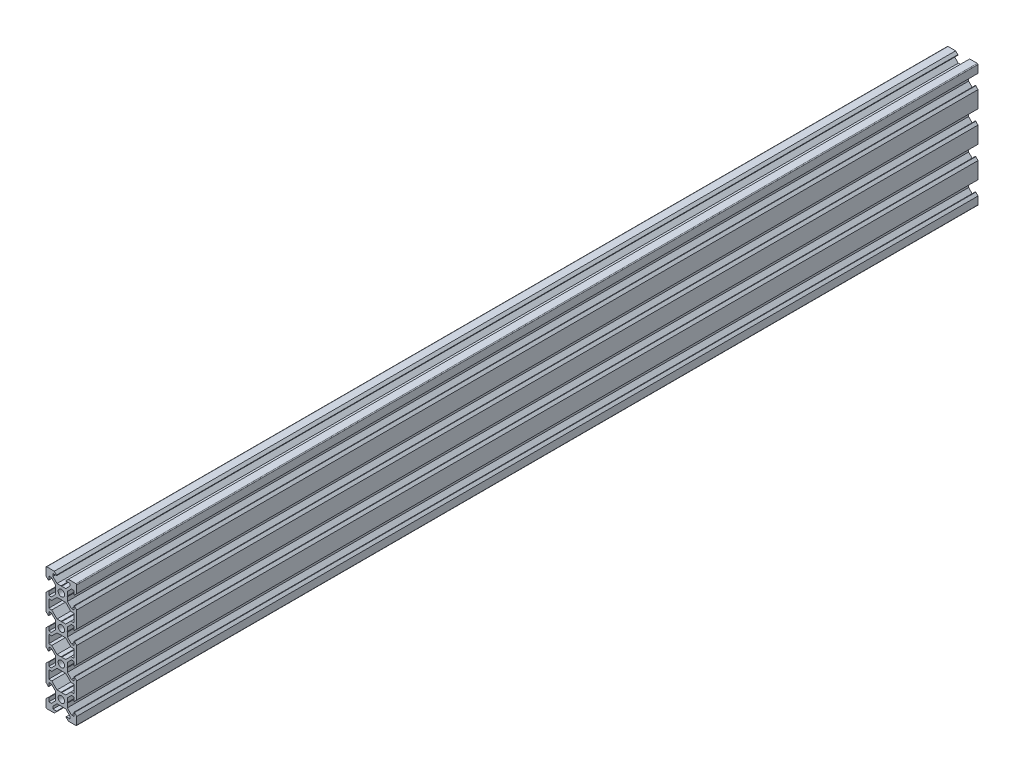
from build123d import *

# Parameters (mm, degrees)
BOSS_EXTRU_1_DEPTH = 586.8


with BuildPart() as part:
    # Esquisse1 → Boss.-Extru.1 (new body)
    with BuildSketch(Plane.XY):
        with BuildLine():
            Line((-9.5, 10), (-4.58, 10))
            Line((-4.58, 10), (-3.125, 8.545))
            Line((-3.125, 8.545), (-3.125, 8.2))
            Line((-3.125, 8.2), (-5.5, 8.2))
            Line((-5.5, 8.2), (-5.5, 6.560660172))
            Line((-5.5, 6.560660172), (-2.839339828, 3.9))
            Line((-2.839339828, 3.9), (-0.21, 3.9))
            Line((-0.21, 3.9), (0, 3.69))
            Line((0, 3.69), (0, 2.1))
            ThreePointArc((0, 2.1), (-2.1, 0), (0, -2.1))
            Line((0, -2.1), (0, -3.69))
            Line((0, -3.69), (-0.21, -3.9))
            Line((-0.21, -3.9), (-2.839339828, -3.9))
            Line((-2.839339828, -3.9), (-6.239339828, -7.3))
            Line((-6.239339828, -7.3), (-8.2, -7.3))
            Line((-8.2, -7.3), (-8.2, -12.7))
            Line((-8.2, -12.7), (-6.239339828, -12.7))
            Line((-6.239339828, -12.7), (-2.839339828, -16.1))
            Line((-2.839339828, -16.1), (-0.21, -16.1))
            Line((-0.21, -16.1), (0, -16.31))
            Line((0, -16.31), (0, -17.9))
            ThreePointArc((0, -17.9), (-2.1, -20), (0, -22.1))
            Line((0, -22.1), (0, -23.69))
            Line((0, -23.69), (-0.21, -23.9))
            Line((-0.21, -23.9), (-2.839339828, -23.9))
            Line((-2.839339828, -23.9), (-6.239339828, -27.3))
            Line((-6.239339828, -27.3), (-8.2, -27.3))
            Line((-8.2, -27.3), (-8.2, -32.7))
            Line((-8.2, -32.7), (-6.239339828, -32.7))
            Line((-6.239339828, -32.7), (-2.839339828, -36.1))
            Line((-2.839339828, -36.1), (-0.21, -36.1))
            Line((-0.21, -36.1), (0, -36.31))
            Line((0, -36.31), (0, -37.9))
            ThreePointArc((0, -37.9), (-2.1, -40), (0, -42.1))
            Line((0, -42.1), (0, -43.69))
            Line((0, -43.69), (-0.21, -43.9))
            Line((-0.21, -43.9), (-2.839339828, -43.9))
            Line((-2.839339828, -43.9), (-6.239339828, -47.3))
            Line((-6.239339828, -47.3), (-8.2, -47.3))
            Line((-8.2, -47.3), (-8.2, -52.7))
            Line((-8.2, -52.7), (-6.239339828, -52.7))
            Line((-6.239339828, -52.7), (-2.839339828, -56.1))
            Line((-2.839339828, -56.1), (-0.21, -56.1))
            Line((-0.21, -56.1), (0, -56.31))
            Line((0, -56.31), (0, -57.9))
            ThreePointArc((0, -57.9), (-2.1, -60), (0, -62.1))
            Line((0, -62.1), (0, -63.69))
            Line((0, -63.69), (-0.21, -63.9))
            Line((-0.21, -63.9), (-2.839339828, -63.9))
            Line((-2.839339828, -63.9), (-5.5, -66.560660172))
            Line((-5.5, -66.560660172), (-5.5, -68.2))
            Line((-5.5, -68.2), (-3.125, -68.2))
            Line((-3.125, -68.2), (-3.125, -68.545))
            Line((-3.125, -68.545), (-4.58, -70))
            Line((-4.58, -70), (-9.5, -70))
            ThreePointArc((-9.5, -70), (-9.853553391, -69.853553391), (-10, -69.5))
            Line((-10, -69.5), (-10, -64.58))
            Line((-10, -64.58), (-8.545, -63.125))
            Line((-8.545, -63.125), (-8.2, -63.125))
            Line((-8.2, -63.125), (-8.2, -65.5))
            Line((-8.2, -65.5), (-6.560660172, -65.5))
            Line((-6.560660172, -65.5), (-3.9, -62.839339828))
            Line((-3.9, -62.839339828), (-3.9, -60.21))
            Line((-3.9, -60.21), (-3.69, -60))
            Line((-3.69, -60), (-3.9, -59.79))
            Line((-3.9, -59.79), (-3.9, -57.160660172))
            Line((-3.9, -57.160660172), (-6.560660172, -54.5))
            Line((-6.560660172, -54.5), (-8.2, -54.5))
            Line((-8.2, -54.5), (-8.2, -56.875))
            Line((-8.2, -56.875), (-8.545, -56.875))
            Line((-8.545, -56.875), (-10, -55.42))
            Line((-10, -55.42), (-10, -44.58))
            Line((-10, -44.58), (-8.545, -43.125))
            Line((-8.545, -43.125), (-8.2, -43.125))
            Line((-8.2, -43.125), (-8.2, -45.5))
            Line((-8.2, -45.5), (-6.560660172, -45.5))
            Line((-6.560660172, -45.5), (-3.9, -42.839339828))
            Line((-3.9, -42.839339828), (-3.9, -40.21))
            Line((-3.9, -40.21), (-3.69, -40))
            Line((-3.69, -40), (-3.9, -39.79))
            Line((-3.9, -39.79), (-3.9, -37.160660172))
            Line((-3.9, -37.160660172), (-6.560660172, -34.5))
            Line((-6.560660172, -34.5), (-8.2, -34.5))
            Line((-8.2, -34.5), (-8.2, -36.875))
            Line((-8.2, -36.875), (-8.545, -36.875))
            Line((-8.545, -36.875), (-10, -35.42))
            Line((-10, -35.42), (-10, -24.58))
            Line((-10, -24.58), (-8.545, -23.125))
            Line((-8.545, -23.125), (-8.2, -23.125))
            Line((-8.2, -23.125), (-8.2, -25.5))
            Line((-8.2, -25.5), (-6.560660172, -25.5))
            Line((-6.560660172, -25.5), (-3.9, -22.839339828))
            Line((-3.9, -22.839339828), (-3.9, -20.21))
            Line((-3.9, -20.21), (-3.69, -20))
            Line((-3.69, -20), (-3.9, -19.79))
            Line((-3.9, -19.79), (-3.9, -17.160660172))
            Line((-3.9, -17.160660172), (-6.560660172, -14.5))
            Line((-6.560660172, -14.5), (-8.2, -14.5))
            Line((-8.2, -14.5), (-8.2, -16.875))
            Line((-8.2, -16.875), (-8.545, -16.875))
            Line((-8.545, -16.875), (-10, -15.42))
            Line((-10, -15.42), (-10, -4.58))
            Line((-10, -4.58), (-8.545, -3.125))
            Line((-8.545, -3.125), (-8.2, -3.125))
            Line((-8.2, -3.125), (-8.2, -5.5))
            Line((-8.2, -5.5), (-6.560660172, -5.5))
            Line((-6.560660172, -5.5), (-3.9, -2.839339828))
            Line((-3.9, -2.839339828), (-3.9, -0.21))
            Line((-3.9, -0.21), (-3.69, 0))
            Line((-3.69, 0), (-3.9, 0.21))
            Line((-3.9, 0.21), (-3.9, 2.839339828))
            Line((-3.9, 2.839339828), (-6.560660172, 5.5))
            Line((-6.560660172, 5.5), (-8.2, 5.5))
            Line((-8.2, 5.5), (-8.2, 3.125))
            Line((-8.2, 3.125), (-8.545, 3.125))
            Line((-8.545, 3.125), (-10, 4.58))
            Line((-10, 4.58), (-10, 9.5))
            ThreePointArc((-10, 9.5), (-9.853553391, 9.853553391), (-9.5, 10))
        make_face()
    boss_extru_1 = extrude(amount=BOSS_EXTRU_1_DEPTH)

    # Symétrie1: Boss.-Extru.1 across plane
    add(boss_extru_1.mirror(Plane(origin=(0, 3.69, 586.8), x_dir=(0, 0, 1), z_dir=(-1, 0, 0))))


solid = part.part
